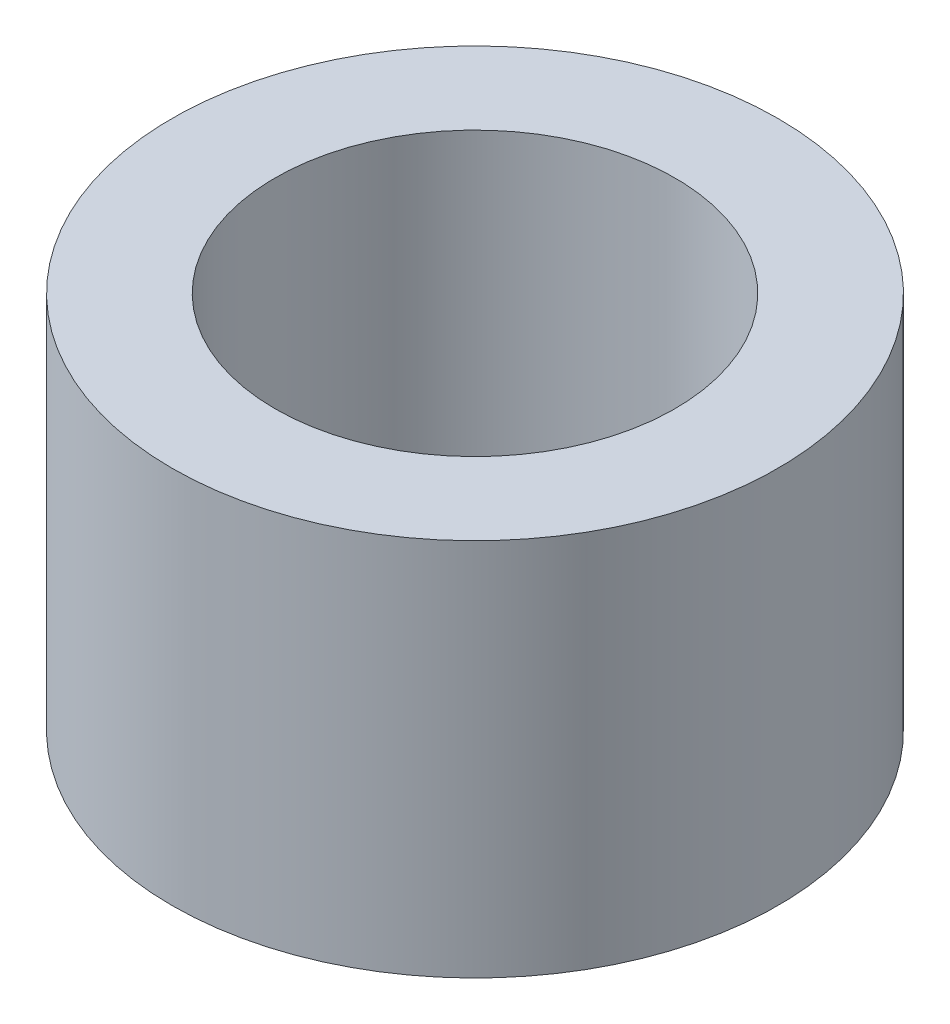
from build123d import *

# Parameters (mm, degrees)
SKETCH1_R           = 12.7
SKETCH1_R_2         = 8.382
BOSS_EXTRUDE1_DEPTH = 15.875


with BuildPart() as part:
    # Sketch1 → Boss-Extrude1 (new body)
    with BuildSketch(Plane(origin=(0, 0, 0), x_dir=(1, 0, 0), z_dir=(0, 1, 0))):
        with Locations(Location((0, 0, 0), (0, 0, 270))):
            Circle(SKETCH1_R)
        with Locations(Location((0, 0, 0), (0, 0, 270))):
            Circle(SKETCH1_R_2, mode=Mode.SUBTRACT)
    extrude(amount=BOSS_EXTRUDE1_DEPTH)


solid = part.part
